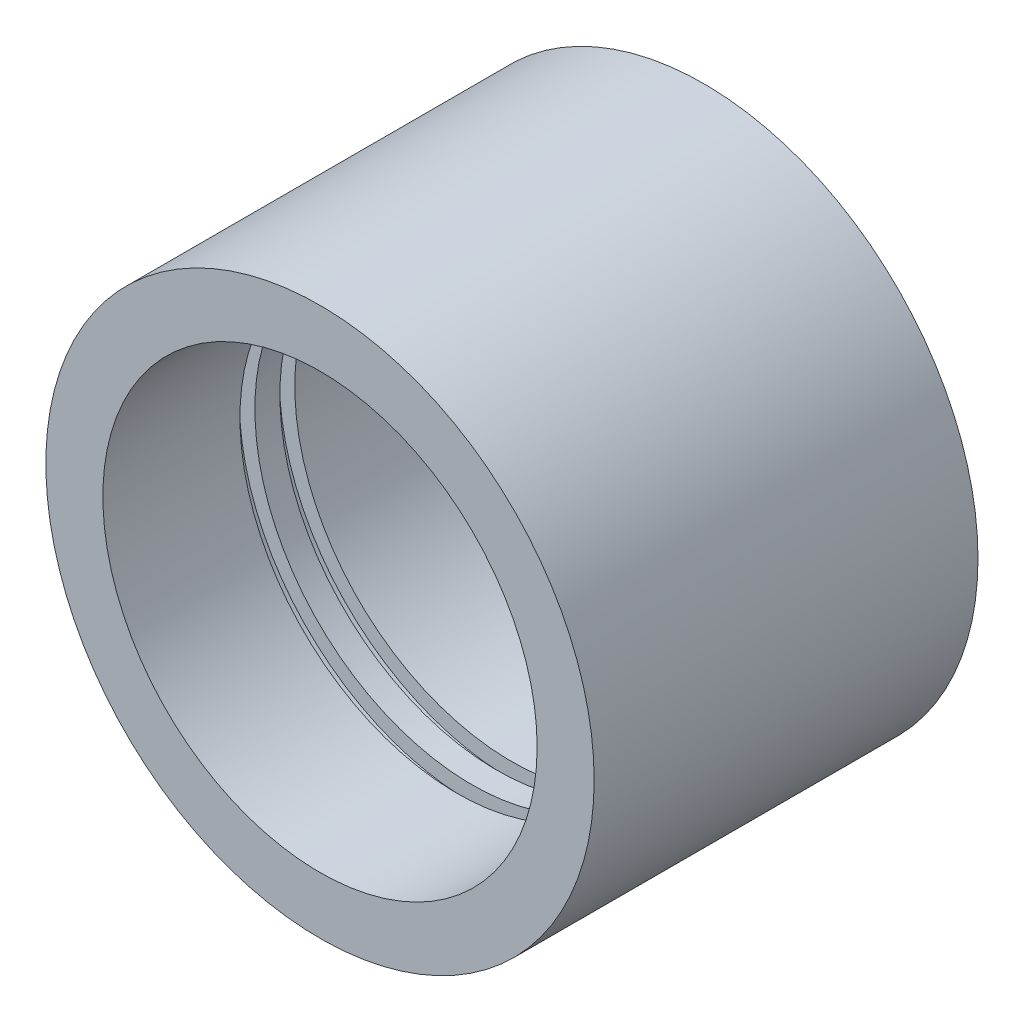
from build123d import *


with BuildPart() as part:
    # Sketch2 → Revolve1 (revolve)
    with BuildSketch(Plane(origin=(0, 0, 0), x_dir=(0, 0, -1), z_dir=(1, 0, 0)), mode=Mode.PRIVATE) as revolve1_sk:
        Polygon((0, 25.146), (0, 31.75), (44.45, 31.75), (44.45, 19.05), (38.1, 19.05), (38.1, 25.146), (22.225, 25.146), (22.225, 26.9494), (20.4978, 26.9494), (20.4978, 25.146), (17.6022, 25.146), (17.6022, 26.9494), (15.875, 26.9494), (15.875, 25.146), align=None)
    revolve(revolve1_sk.sketch.rotate(Axis((0, 0, 0), (0, 0, -1)), 90), axis=Axis((0, 0, 0), (0, 0, -1)))


solid = part.part
